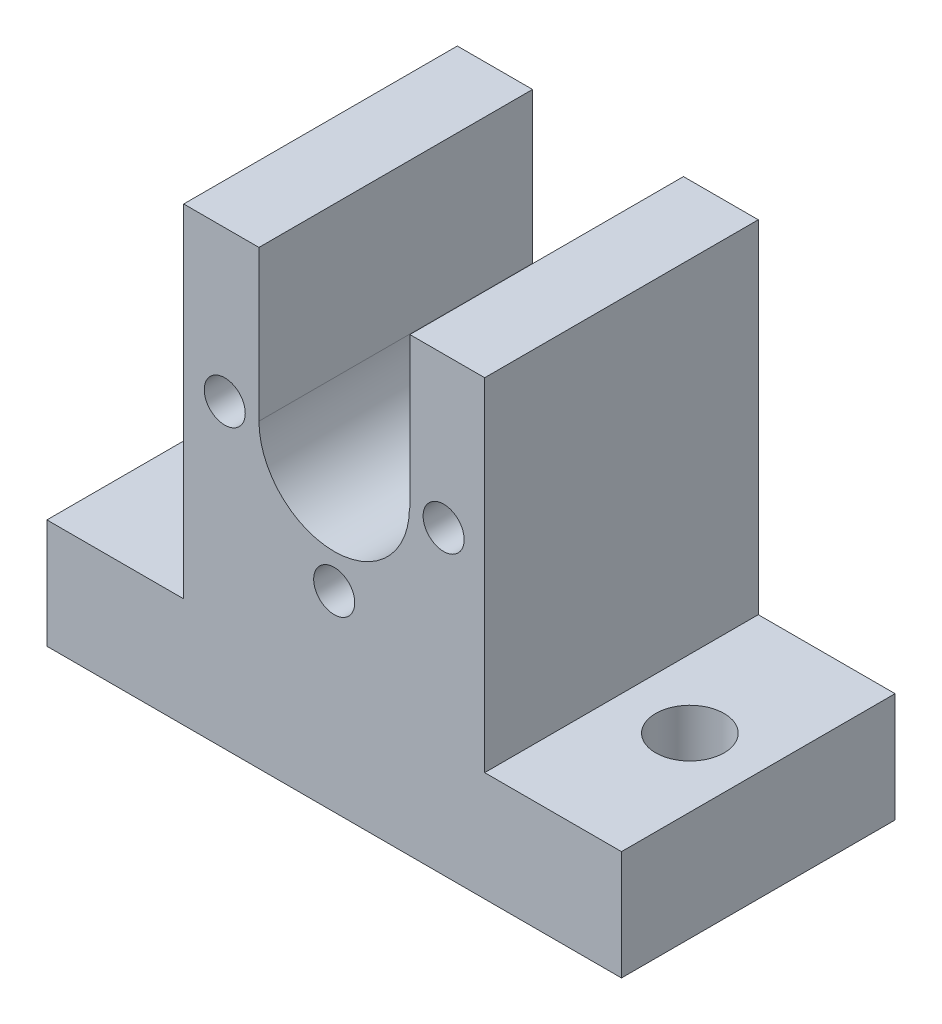
from build123d import *

# Parameters (mm, degrees)
SKETCH_1_R          = 1.5
EXTRUDE_1_DEPTH     = 20
SKETCH_2_R          = 2.5
CUT_EXTRUDE_1_DEPTH = 20


with BuildPart() as part:
    # 草图1 → 凸台-拉伸1 (new body)
    with BuildSketch(Plane.XY):
        with BuildLine():
            Line((21.673469388, -17.884353741), (21.673469388, -9.884353741))
            Line((21.673469388, -9.884353741), (11.673469388, -9.884353741))
            Line((11.673469388, -9.884353741), (11.673469388, 15.115646259))
            Line((11.673469388, 15.115646259), (6.205006293, 15.115646259))
            Line((6.205006293, 15.115646259), (6.205006293, 4.115646259))
            Line((6.205006293, 4.115646259), (6.173469388, 4.115646259))
            ThreePointArc((6.173469388, 4.115646259), (0.673469388, -1.384353741), (-4.826530612, 4.115646259))
            Line((-4.826530612, 4.115646259), (-4.826530612, 15.115646259))
            Line((-4.826530612, 15.115646259), (-10.326530612, 15.115646259))
            Line((-10.326530612, 15.115646259), (-10.326530612, -9.884353741))
            Line((-10.326530612, -9.884353741), (-20.326530612, -9.884353741))
            Line((-20.326530612, -9.884353741), (-20.326530612, -17.884353741))
            Line((-20.326530612, -17.884353741), (21.673469388, -17.884353741))
        make_face()
        with Locations((0.673469388, -3.884353741)):
            Circle(SKETCH_1_R, mode=Mode.SUBTRACT)
        with Locations((-7.326530612, 4.115646259)):
            Circle(SKETCH_1_R, mode=Mode.SUBTRACT)
        with Locations((8.673469388, 4.115646259)):
            Circle(SKETCH_1_R, mode=Mode.SUBTRACT)
    extrude(amount=EXTRUDE_1_DEPTH)

    # 草图2 → 切除-拉伸1 (cut)
    with BuildSketch(Plane(origin=(0, -9.884353741, 0), x_dir=(1, 0, 0), z_dir=(0, 1, 0))):
        with Locations((16.673469388, -10)):
            Circle(SKETCH_2_R)
        with Locations((-15.326530612, -10)):
            Circle(SKETCH_2_R)
    extrude(amount=-CUT_EXTRUDE_1_DEPTH, mode=Mode.SUBTRACT)


solid = part.part
